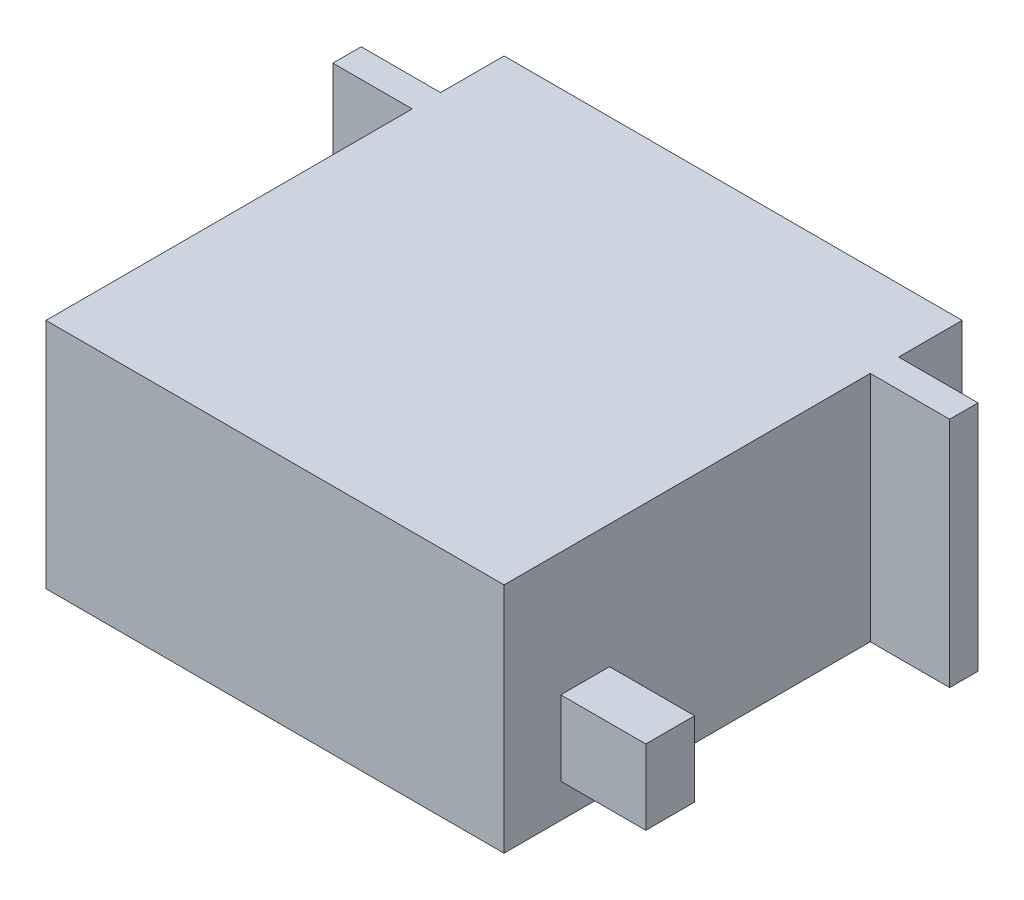
from build123d import *

# Parameters (mm, degrees)
SKETCH2_W           = 7
SKETCH2_H           = 2.5
BOSS_EXTRUDE3_DEPTH = 20.5
SKETCH4_W           = 4.3
SKETCH4_H           = 6.6
WIRE_2_DEPTH        = 7.5
SKETCH6_R           = 3
BOSS_EXTRUDE5_DEPTH = 6.4


with BuildPart() as part:
    # Sketch2 → Boss-Extrude3 (new body)
    with BuildSketch(Plane(origin=(0, 0, 0), x_dir=(1, 0, 0), z_dir=(0, 1, 0))):
        with Locations((-26.15465113, 5.213732574)):
            Rectangle(SKETCH2_W, SKETCH2_H)
        Polygon((-2.45465113, -28.336267426), (-2.45465113, 12.063732574), (-22.65465113, 12.063732574), (-22.65465113, 6.463732574), (-22.65465113, 3.963732574), (-22.65465113, -28.336267426), align=None)
        Polygon((17.74534887, 12.063732574), (-2.45465113, 12.063732574), (-2.45465113, -28.336267426), (17.74534887, -28.336267426), (17.74534887, 3.963732574), (17.74534887, 6.463732574), align=None)
        with Locations((21.24534887, 5.213732574)):
            Rectangle(SKETCH2_W, SKETCH2_H)
    extrude(amount=BOSS_EXTRUDE3_DEPTH)

    # Sketch4 → Wire 2 (add)
    with BuildSketch(Plane(origin=(17.74534887, 0, 0), x_dir=(0, 0, -1), z_dir=(1, 0, 0))):
        with Locations((-21.186267426, 6.3)):
            Rectangle(SKETCH4_W, SKETCH4_H)
    extrude(amount=WIRE_2_DEPTH)

    # Sketch6 → Boss-Extrude5 (add)
    with BuildSketch(Plane(origin=(0, 0, -12.063732574), x_dir=(-1, 0, 0), z_dir=(0, 0, -1))):
        with Locations((-8.24534887, 11)):
            Circle(SKETCH6_R)
    extrude(amount=BOSS_EXTRUDE5_DEPTH)


solid = part.part
